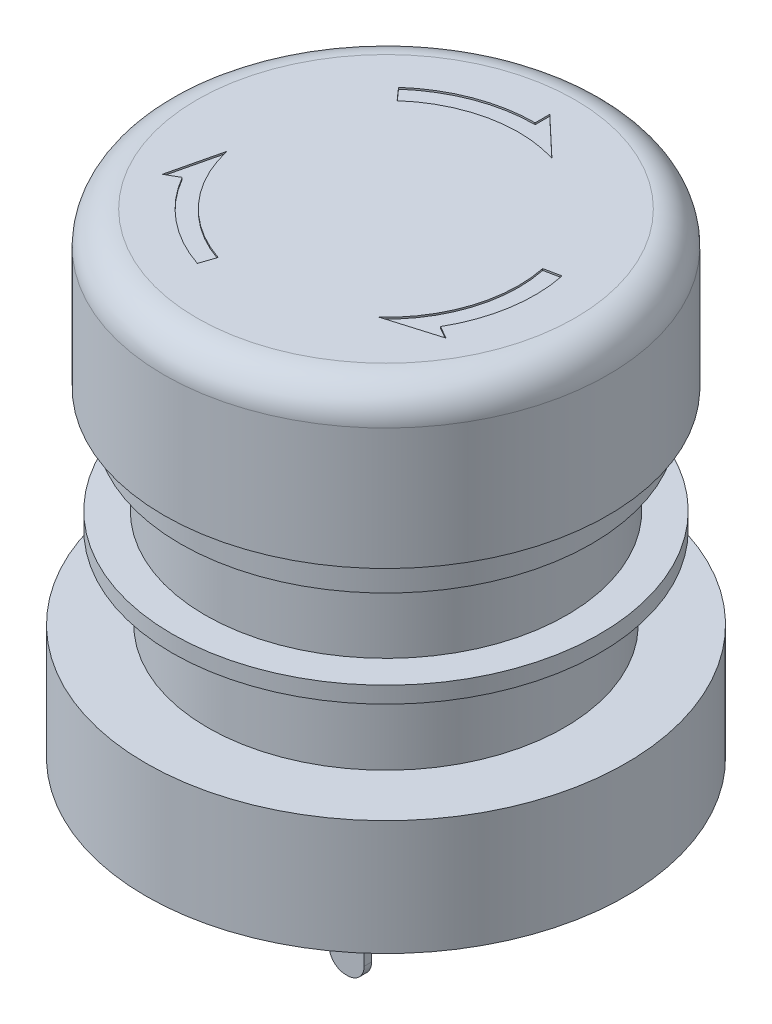
from build123d import *

# Parameters (mm, degrees)
SKETCH_1_R          = 7.5
EXTRUDE_1_DEPTH     = 2
SKETCH_2_W          = 2.124250946
SKETCH_2_H          = 0.455196631
EXTRUDE_2_DEPTH     = 3.5
FILLET_1_R          = 1
SKETCH_4_R          = 10.85
EXTRUDE_3_DEPTH     = 8.6
SKETCH_5_R          = 13
EXTRUDE_4_DEPTH     = 6
SKETCH_7_R          = 11
EXTRUDE_6_DEPTH     = 4.5
SKETCH_8_R          = 13.5
EXTRUDE_7_DEPTH     = 11.4
FILLET_5_R          = 2
SKETCH_9_OUTSIDE_W  = 39.496
SKETCH_9_OUTSIDE_H  = 39.496
SKETCH_9_OUTSIDE_R  = 12.5
CUT_EXTRUDE_1_DEPTH = 2
CUT_EXTRUDE_2_DEPTH = 0.1
SKETCH_11_R         = 14.605
EXTRUDE_8_DEPTH     = 7
SKETCH_12_R         = 13
SKETCH_12_R_2       = 10.85
CUT_EXTRUDE_3_DEPTH = 5


with BuildPart() as part:
    # 草图1 → 凸台-拉伸1 (new body)
    with BuildSketch(Plane(origin=(0, 0, 0), x_dir=(1, 0, 0), z_dir=(0, 1, 0))):
        with Locations(Location((0, 0, 0), (0, 0, 270))):
            Circle(SKETCH_1_R)
    extrude(amount=EXTRUDE_1_DEPTH)

    # 草图2 → 凸台-拉伸2 (add)
    with BuildSketch(Plane.XZ):
        with Locations((-3.169695017, 5.334335524)):
            Rectangle(SKETCH_2_W, SKETCH_2_H)
        with Locations((3.169695017, 5.334335524)):
            Rectangle(SKETCH_2_W, SKETCH_2_H)
        with Locations((3.169695017, -5.334335524)):
            Rectangle(SKETCH_2_W, SKETCH_2_H)
        with Locations((-3.169695017, -5.334335524)):
            Rectangle(SKETCH_2_W, SKETCH_2_H)
    extrude(amount=EXTRUDE_2_DEPTH)

    # 圆角1
    fillet_1_edges = [part.edges().sort_by_distance(p)[0] for p in [
        (4.23182049, -3.5, 5.334335524),
        (2.107569544, -3.5, 5.334335524),
        (4.23182049, -3.5, -5.334335524),
        (2.107569544, -3.5, -5.334335524),
        (-4.23182049, -3.5, -5.334335524),
        (-2.107569544, -3.5, -5.334335524),
        (-2.107569544, -3.5, 5.334335524),
        (-4.23182049, -3.5, 5.334335524),
    ]]
    fillet(fillet_1_edges, radius=FILLET_1_R)

    # 草图4 → 凸台-拉伸3 (add)
    with BuildSketch(Plane(origin=(0, 2, 0), x_dir=(1, 0, 0), z_dir=(0, 1, 0))):
        with Locations(Location((0, 0, 0), (0, 0, 90))):
            Circle(SKETCH_4_R)
    extrude(amount=EXTRUDE_3_DEPTH)

    # 草图5 → 凸台-拉伸4 (add)
    with BuildSketch(Plane(origin=(0, 10.6, 0), x_dir=(1, 0, 0), z_dir=(0, 1, 0))):
        with Locations(Location((0, 0, 0), (0, 0, 270))):
            Circle(SKETCH_5_R)
    extrude(amount=EXTRUDE_4_DEPTH)

    # 草图7 → 凸台-拉伸6 (add)
    with BuildSketch(Plane(origin=(0, 16.6, 0), x_dir=(1, 0, 0), z_dir=(0, 1, 0))):
        with Locations(Location((0, 0, 0), (0, 0, 270))):
            Circle(SKETCH_7_R)
    extrude(amount=EXTRUDE_6_DEPTH)

    # 草图8 → 凸台-拉伸7 (add)
    with BuildSketch(Plane(origin=(0, 21.1, 0), x_dir=(1, 0, 0), z_dir=(0, 1, 0))):
        with Locations(Location((0, 0, 0), (0, 0, 270))):
            Circle(SKETCH_8_R)
    extrude(amount=EXTRUDE_7_DEPTH)

    # 圆角5
    fillet_5_edges = [part.edges().sort_by_distance(p)[0] for p in [
        (0, 32.5, -13.5),
    ]]
    fillet(fillet_5_edges, radius=FILLET_5_R)

    # 草图9 outside → 切除-拉伸1 (cut)
    with BuildSketch(Plane.XZ.offset(-21.1)):
        Rectangle(SKETCH_9_OUTSIDE_W, SKETCH_9_OUTSIDE_H)
        with Locations(Location((0, 0, 0), (0, 0, 270))):
            Circle(SKETCH_9_OUTSIDE_R, mode=Mode.SUBTRACT)
    extrude(amount=-CUT_EXTRUDE_1_DEPTH, mode=Mode.SUBTRACT)

    # 草图10 → 切除-拉伸2 (cut)
    with BuildSketch(Plane(origin=(0, 32.5, 0), x_dir=(1, 0, 0), z_dir=(0, 1, 0))):
        with BuildLine():
            Line((0, 9.073721602), (0, 9.961907626))
            Line((0, 9.961907626), (2.376046015, 7.716176893))
            ThreePointArc((2.376046015, 7.716176893), (-1.712152333, 7.890089663), (-5.36056205, 6.037330123))
            Line((-5.36056205, 6.037330123), (-6.024513857, 6.785105489))
            ThreePointArc((-6.024513857, 6.785105489), (-3.222286879, 8.48229279), (0, 9.073721602))
        make_face()
        with BuildLine():
            Line((8.627265074, -4.980953813), (5.494382202, -5.915804656))
            ThreePointArc((5.494382202, -5.915804656), (7.689094253, -2.462277416), (7.908762283, 1.623717852))
            Line((7.908762283, 1.623717852), (8.888330649, 1.824829301))
            ThreePointArc((8.888330649, 1.824829301), (8.957024478, -1.450564099), (7.858073414, -4.536860801))
            Line((7.858073414, -4.536860801), (8.627265074, -4.980953813))
        make_face()
        with BuildLine():
            Line((-8.627265074, -4.980953813), (-7.870428217, -1.800372237))
            ThreePointArc((-7.870428217, -1.800372237), (-5.97694192, -5.427812247), (-2.548200233, -7.661047975))
            Line((-2.548200233, -7.661047975), (-2.863816792, -8.60993479))
            ThreePointArc((-2.863816792, -8.60993479), (-5.734737599, -7.031728691), (-7.858073414, -4.536860801))
            Line((-7.858073414, -4.536860801), (-8.627265074, -4.980953813))
        make_face()
    extrude(amount=-CUT_EXTRUDE_2_DEPTH, mode=Mode.SUBTRACT)

    # 草图11 → 凸台-拉伸8 (add)
    with BuildSketch(Plane.XZ.offset(-10.6)):
        with Locations(Location((0, 0, 0), (0, 0, 270))):
            Circle(SKETCH_11_R)
    extrude(amount=EXTRUDE_8_DEPTH)

    # 草图12 → 切除-拉伸3 (cut)
    with BuildSketch(Plane(origin=(0, 10.6, 0), x_dir=(1, 0, 0), z_dir=(0, 1, 0))):
        with Locations(Location((0, 0, 0), (0, 0, 270))):
            Circle(SKETCH_12_R)
        with Locations(Location((0, 0, 0), (0, 0, 270))):
            Circle(SKETCH_12_R_2, mode=Mode.SUBTRACT)
    extrude(amount=CUT_EXTRUDE_3_DEPTH, mode=Mode.SUBTRACT)


solid = part.part
